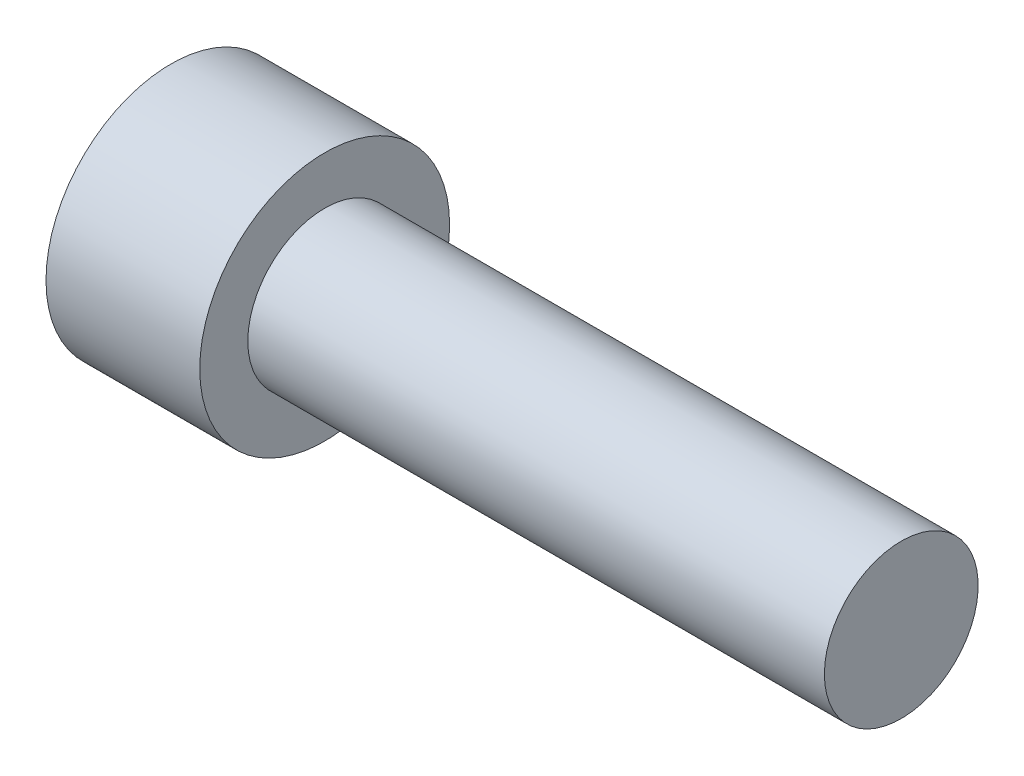
from build123d import *

# Parameters (mm, degrees)
CUT_EXTRUDE1_DEPTH = 4


with BuildPart() as part:
    # Sketch1 → Revolve1 (revolve)
    with BuildSketch(Plane.XY, mode=Mode.PRIVATE) as revolve1_sk:
        Polygon((0, 0), (0, 6.5), (8, 6.5), (8, 4), (38, 4), (38, 0), align=None)
    revolve(revolve1_sk.sketch.rotate(Axis((0, 0, 0), (1, 0, 0)), 90), axis=Axis((0, 0, 0), (1, 0, 0)))

    # Sketch2 → Cut-Revolve1 (revolve, cut)
    with BuildSketch(Plane.XY, mode=Mode.PRIVATE) as cut_revolve1_sk:
        Polygon((0, 3), (4, 3), (5.732050808, 0), (0, 0), align=None)
    revolve(cut_revolve1_sk.sketch.rotate(Axis((0, 0, 0), (1, 0, 0)), 180), axis=Axis((0, 0, 0), (1, 0, 0)), mode=Mode.SUBTRACT)

    # Sketch3 → Cut-Extrude1 (cut)
    with BuildSketch(Plane.ZY):
        Polygon((0, -3.464101615), (3, -1.732050808), (3, 1.732050808), (0, 3.464101615), (-3, 1.732050808), (-3, -1.732050808), align=None)
    extrude(amount=-CUT_EXTRUDE1_DEPTH, mode=Mode.SUBTRACT)


solid = part.part
